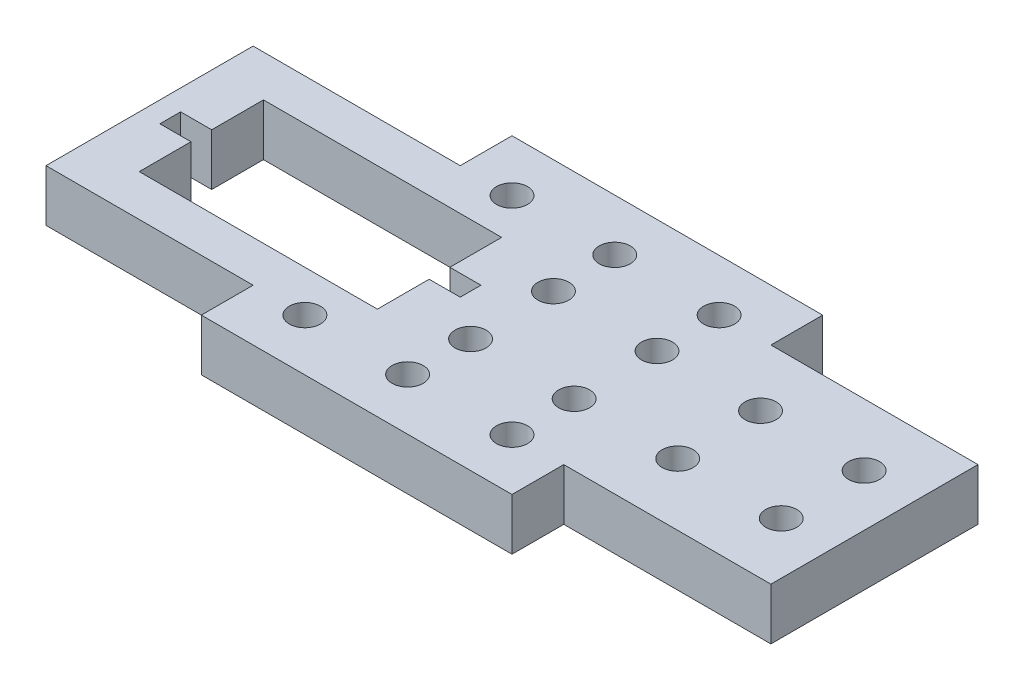
from build123d import *

# Parameters (mm, degrees)
SKETCH_1_R      = 1.5
EXTRUDE_1_DEPTH = 5


with BuildPart() as part:
    # 草图1 → 凸台-拉伸1 (new body)
    with BuildSketch(Plane(origin=(0, 0, 0), x_dir=(1, 0, 0), z_dir=(0, 1, 0))):
        Polygon((50, 20), (70, 20), (70, 0), (50, 0), (50, -5), (20, -5), (20, 0), (0, 0), (0, 20), (20, 20), (20, 25), (50, 25), align=None)
        with Locations(Location((25, 20, 0), (0, 0, 270))):
            Circle(SKETCH_1_R, mode=Mode.SUBTRACT)
        with Locations(Location((34.920753824, 20, 0), (0, 0, 270))):
            Circle(SKETCH_1_R, mode=Mode.SUBTRACT)
        with Locations(Location((45, 20, 0), (0, 0, 270))):
            Circle(SKETCH_1_R, mode=Mode.SUBTRACT)
        with Locations(Location((35, 14, 0), (0, 0, 270))):
            Circle(SKETCH_1_R, mode=Mode.SUBTRACT)
        with Locations(Location((45, 14, 0), (0, 0, 270))):
            Circle(SKETCH_1_R, mode=Mode.SUBTRACT)
        with Locations(Location((35, 6, 0), (0, 0, 270))):
            Circle(SKETCH_1_R, mode=Mode.SUBTRACT)
        with Locations(Location((34.920753824, 0, 0), (0, 0, 270))):
            Circle(SKETCH_1_R, mode=Mode.SUBTRACT)
        with Locations(Location((45, 0, 0), (0, 0, 270))):
            Circle(SKETCH_1_R, mode=Mode.SUBTRACT)
        with Locations(Location((45, 6, 0), (0, 0, 270))):
            Circle(SKETCH_1_R, mode=Mode.SUBTRACT)
        with Locations(Location((55, 14, 0), (0, 0, 270))):
            Circle(SKETCH_1_R, mode=Mode.SUBTRACT)
        with Locations(Location((55, 6, 0), (0, 0, 270))):
            Circle(SKETCH_1_R, mode=Mode.SUBTRACT)
        with Locations(Location((65, 14, 0), (0, 0, 270))):
            Circle(SKETCH_1_R, mode=Mode.SUBTRACT)
        with Locations(Location((65, 6, 0), (0, 0, 270))):
            Circle(SKETCH_1_R, mode=Mode.SUBTRACT)
        with Locations(Location((25, 0, 0), (0, 0, 270))):
            Circle(SKETCH_1_R, mode=Mode.SUBTRACT)
        Polygon((5, 16), (28, 16), (28, 11), (31, 11), (31, 9), (28, 9), (28, 4), (5, 4), (5, 9), (2, 9), (2, 11), (5, 11), align=None, mode=Mode.SUBTRACT)
    extrude(amount=EXTRUDE_1_DEPTH)


solid = part.part
